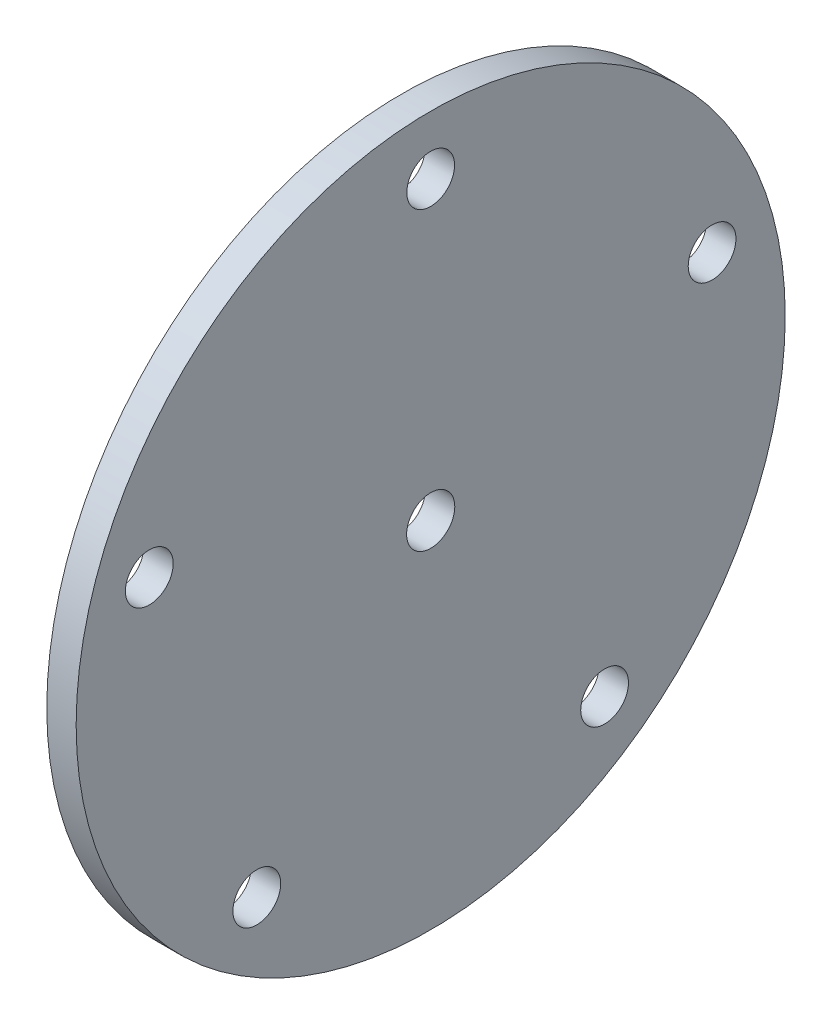
from build123d import *

# Parameters (mm, degrees)
SKETCH1_R           = 60.325
BOSS_EXTRUDE1_DEPTH = 2.5
SKETCH2_R           = 4.064
CUT_EXTRUDE1_DEPTH  = 86.458827806
SKETCH8_R           = 4.1
CUT_EXTRUDE4_DEPTH  = 86.458827806


with BuildPart() as part:
    # Sketch1 → Boss-Extrude1 (new, symmetric)
    with BuildSketch(Plane(origin=(0, 0, 0), x_dir=(0, 0, -1), z_dir=(1, 0, 0))):
        Circle(SKETCH1_R)
    extrude(amount=BOSS_EXTRUDE1_DEPTH, both=True)

    # Sketch2 → Cut-Extrude1 (cut, through all)
    with BuildSketch(Plane.ZY.offset(2.5)):
        with Locations((0, 50.342959834)):
            Circle(SKETCH2_R)
        with Locations((47.879, 15.556830136)):
            Circle(SKETCH2_R)
        with Locations((29.590849347, -40.728310053)):
            Circle(SKETCH2_R)
        with Locations((-29.590849347, -40.728310053)):
            Circle(SKETCH2_R)
        with Locations((-47.879, 15.556830136)):
            Circle(SKETCH2_R)
    extrude(amount=-CUT_EXTRUDE1_DEPTH, mode=Mode.SUBTRACT)

    # Sketch8 → Cut-Extrude4 (cut, through all)
    with BuildSketch(Plane(origin=(2.5, 0, 0), x_dir=(0, 0, -1), z_dir=(1, 0, 0))):
        Circle(SKETCH8_R)
    extrude(amount=-CUT_EXTRUDE4_DEPTH, mode=Mode.SUBTRACT)


solid = part.part
